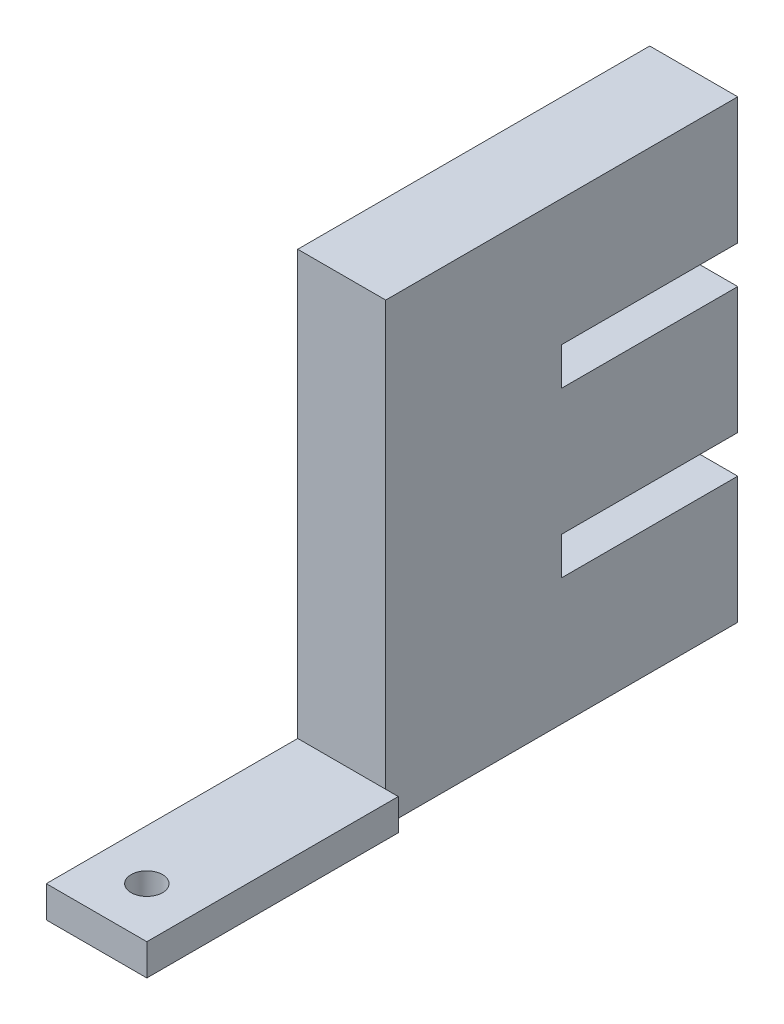
from build123d import *

# Parameters (mm, degrees)
S_BOX1_W       = 8
S_BOX1_H       = 2.5
BOSS_1_DEPTH   = 20
S_BOX2_W       = 7
S_BOX2_H       = 36.2
BOSS_2_DEPTH   = 28
S_HOLE3_R      = 1.25
HOLE_3_DEPTH   = 2.7
S_CUT4_W       = 7.2
S_CUT4_H       = 3
POCKET_4_DEPTH = 14.1
S_CUT5_W       = 7.2
S_CUT5_H       = 3
POCKET_5_DEPTH = 14.1


with BuildPart() as part:
    # S_box1 → Boss_1 (new body)
    with BuildSketch(Plane.XY.offset(-16)):
        with Locations((0, -3.25)):
            Rectangle(S_BOX1_W, S_BOX1_H)
    extrude(amount=BOSS_1_DEPTH)

    # S_box2 → Boss_2 (add)
    with BuildSketch(Plane.XY.offset(-44)):
        with Locations((-0.5, 13.6)):
            Rectangle(S_BOX2_W, S_BOX2_H)
    extrude(amount=BOSS_2_DEPTH)

    # S_hole3 → Hole_3 (cut)
    with BuildSketch(Plane(origin=(0, -4.6, 0), x_dir=(1, 0, 0), z_dir=(0, 1, 0))):
        with Locations(Location((0, 0, 0), (0, 0, 90))):
            Circle(S_HOLE3_R)
    extrude(amount=HOLE_3_DEPTH, mode=Mode.SUBTRACT)

    # S_cut4 → Pocket_4 (cut)
    with BuildSketch(Plane.XY.offset(-44.1)):
        with Locations((-0.5, 7.07)):
            Rectangle(S_CUT4_W, S_CUT4_H)
    extrude(amount=POCKET_4_DEPTH, mode=Mode.SUBTRACT)

    # S_cut5 → Pocket_5 (cut)
    with BuildSketch(Plane.XY.offset(-44.1)):
        with Locations((-0.5, 20.13)):
            Rectangle(S_CUT5_W, S_CUT5_H)
    extrude(amount=POCKET_5_DEPTH, mode=Mode.SUBTRACT)


solid = part.part
